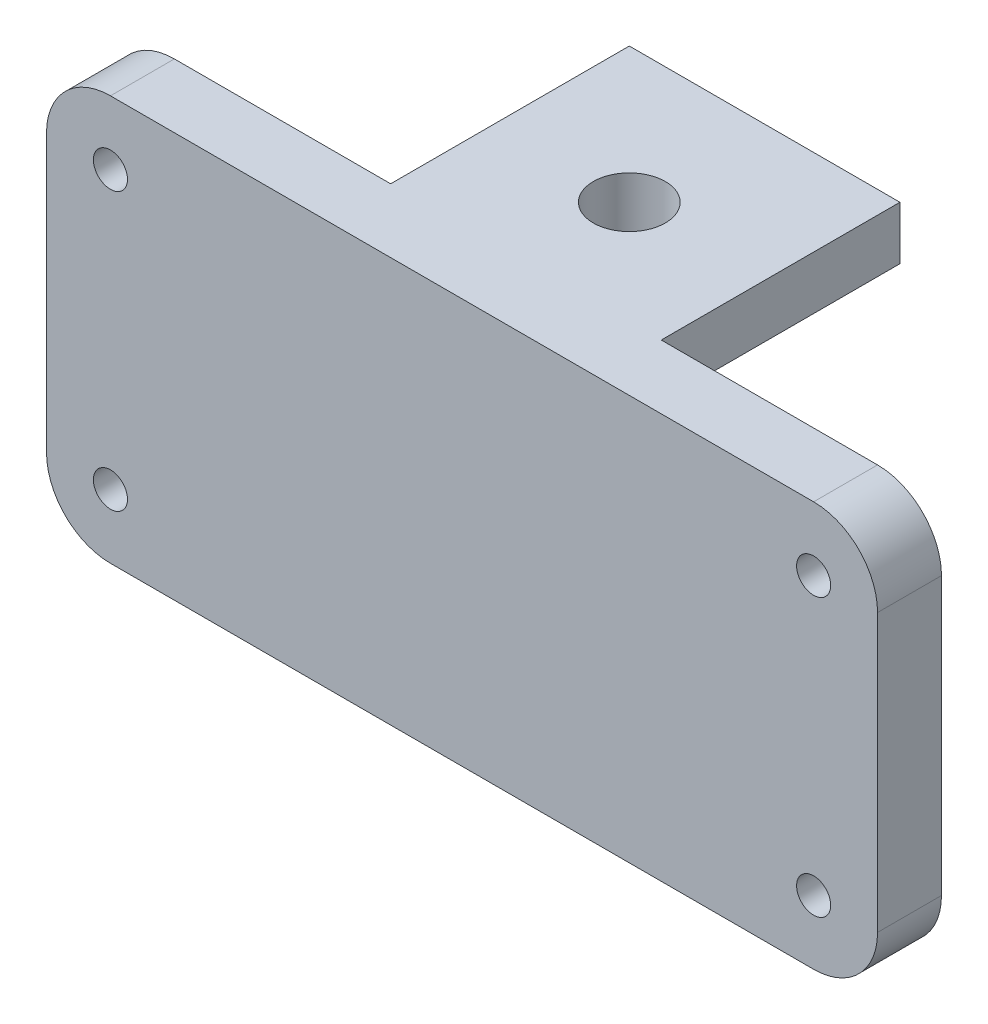
from build123d import *

# Parameters (mm, degrees)
SKETCH1_W               = 25.4
SKETCH1_H               = 25.4
BOSS_EXTRUDE1_DEPTH     = 5
F_1_4_CLEARANCE_HOLE1_D = 6.7564
SKETCH4_R               = 1.6
SKETCH4_W               = 25.4
SKETCH4_H               = 5
BOSS_EXTRUDE2_DEPTH     = 3
FILLET1_R               = 6


with BuildPart() as part:
    # Sketch1 → Boss-Extrude1 (new body)
    with BuildSketch(Plane(origin=(0, 0, 0), x_dir=(1, 0, 0), z_dir=(0, 1, 0))):
        Rectangle(SKETCH1_W, SKETCH1_H)
    extrude(amount=BOSS_EXTRUDE1_DEPTH)

    # 1/4 Clearance Hole1 (through all)
    with Locations(Plane(origin=(0, 5, 0), x_dir=(1, 0, 0), z_dir=(0, 1, 0))):
        with Locations((0, 0)):
            Hole(F_1_4_CLEARANCE_HOLE1_D / 2)

    # Sketch4 → Boss-Extrude2 (add, symmetric)
    # profile 1 of 2: a face of its own
    with BuildSketch(Plane.XY.offset(12.7)):
        Polygon((-39, 5), (-39, -33), (39, -33), (39, 5), (12.7, 5), (12.7, 0), (-12.7, 0), (-12.7, 5), align=None)
        with Locations((-33, -27)):
            Circle(SKETCH4_R, mode=Mode.SUBTRACT)
        with Locations((33, -27)):
            Circle(SKETCH4_R, mode=Mode.SUBTRACT)
        with Locations((-33, -1)):
            Circle(SKETCH4_R, mode=Mode.SUBTRACT)
        with Locations((33, -1)):
            Circle(SKETCH4_R, mode=Mode.SUBTRACT)
    # profile 2 of 2: a face of its own
    with BuildSketch(Plane.XY.offset(12.7)):
        with Locations((0, 2.5)):
            Rectangle(SKETCH4_W, SKETCH4_H)
    extrude(amount=BOSS_EXTRUDE2_DEPTH, both=True)

    # Fillet1
    fillet1_edges = [part.edges().sort_by_distance(p)[0] for p in [
        (-39, 5, 12.7),
        (39, 5, 12.7),
        (39, -33, 12.7),
        (-39, -33, 12.7),
    ]]
    fillet(fillet1_edges, radius=FILLET1_R)


solid = part.part
